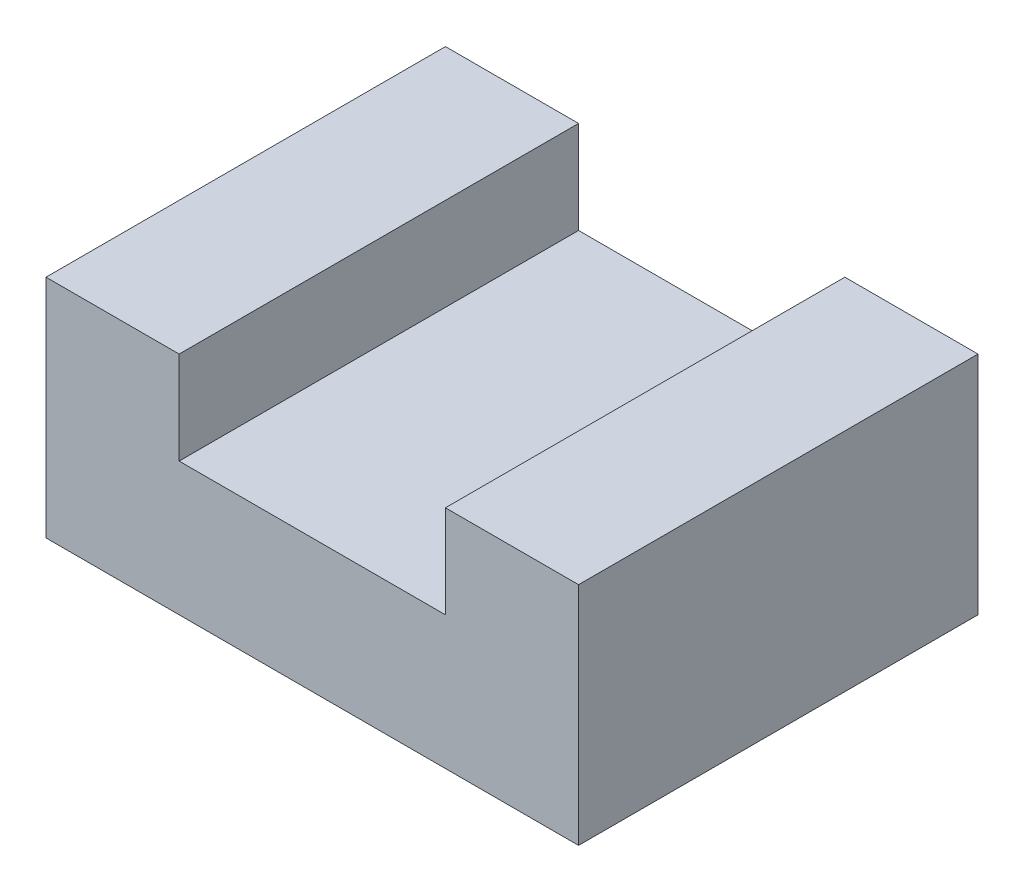
from build123d import *

# Parameters (mm, degrees)
SKETCH1_W           = 20
SKETCH1_H           = 15
BOSS_EXTRUDE1_DEPTH = 5
SKETCH3_W           = 5
SKETCH3_H           = 3.480811901
BOSS_EXTRUDE2_DEPTH = 15


with BuildPart() as part:
    # Sketch1 → Boss-Extrude1 (new body)
    with BuildSketch(Plane(origin=(0, 0, 0), x_dir=(1, 0, 0), z_dir=(0, 1, 0))):
        with Locations((10, 7.5)):
            Rectangle(SKETCH1_W, SKETCH1_H)
    extrude(amount=BOSS_EXTRUDE1_DEPTH)

    # Sketch3 → Boss-Extrude2 (add)
    with BuildSketch(Plane.XY):
        with Locations((2.5, 6.740405951)):
            Rectangle(SKETCH3_W, SKETCH3_H)
        with Locations((17.5, 6.740405951)):
            Rectangle(SKETCH3_W, SKETCH3_H)
    extrude(amount=-BOSS_EXTRUDE2_DEPTH)


solid = part.part
